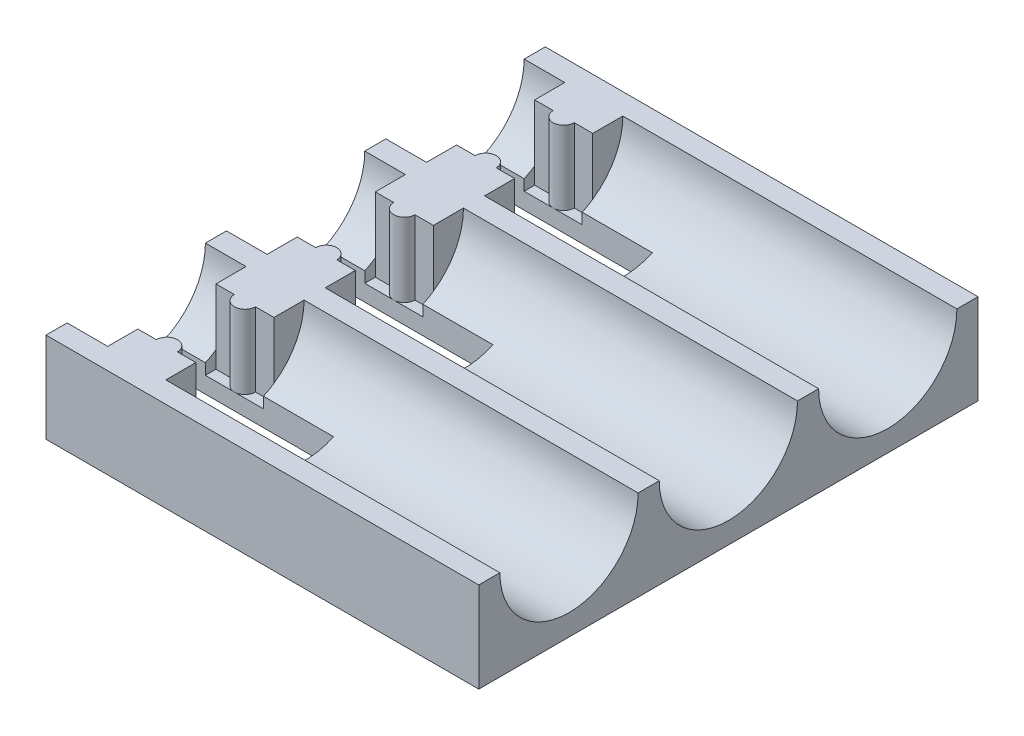
from build123d import *

# Parameters (mm, degrees)
BOSS_EXTRUDE1_DEPTH     = 41
BOSS_EXTRUDE2_REACH     = 50.098
SKETCH2_R               = 1
SKETCH4_W               = 5.5
SKETCH4_H               = 13.1
SKETCH4_R               = 1
CUT_EXTRUDE1_DEPTH      = 7
BOSS_EXTRUDE4_REACH     = 50.098
SKETCH6_W               = 5.5
SKETCH6_H               = 2.85
CUT_EXTRUDE2_DEPTH      = 48.846865116
CUT_EXTRUDE2_DEPTH_BACK = 48.846865116
SKETCH7_W               = 16
SKETCH7_H               = 5.4


with BuildPart() as part:
    # Sketch1 → Boss-Extrude1 (new body)
    with BuildSketch(Plane(origin=(0, 0, 0), x_dir=(0, 0, -1), z_dir=(1, 0, 0))):
        with BuildLine():
            Line((-8.55, 0), (-6.55, 0))
            ThreePointArc((-6.55, 0), (0, -6.55), (6.55, 0))
            Line((6.55, 0), (8.55, 0))
            ThreePointArc((8.55, 0), (15.1, -6.55), (21.65, 0))
            Line((21.65, 0), (23.65, 0))
            Line((23.65, 0), (23.65, -8.55))
            Line((23.65, -8.55), (-23.65, -8.55))
            Line((-23.65, -8.55), (-23.65, 0))
            Line((-23.65, 0), (-21.65, 0))
            ThreePointArc((-21.65, 0), (-15.1, -6.55), (-8.55, 0))
        make_face()
    extrude(amount=BOSS_EXTRUDE1_DEPTH)

    # Sketch2 → Boss-Extrude2 (add, up to next)
    with BuildSketch(Plane(origin=(0, 0, 0), x_dir=(1, 0, 0), z_dir=(0, 1, 0)), mode=Mode.PRIVATE) as boss_extrude2_sk1:
        with Locations(Location((6.6, 3.7, 0), (0, 0, 270))):
            Circle(SKETCH2_R)
    boss_extrude2_tool1 = extrude(boss_extrude2_sk1.sketch, amount=-BOSS_EXTRUDE2_REACH, mode=Mode.PRIVATE) - part.part
    # Sketch2 → Boss-Extrude2 (add, up to next)
    with BuildSketch(Plane(origin=(0, 0, 0), x_dir=(1, 0, 0), z_dir=(0, 1, 0)), mode=Mode.PRIVATE) as boss_extrude2_sk2:
        with Locations(Location((6.6, -3.7, 0), (0, 0, 270))):
            Circle(SKETCH2_R)
    boss_extrude2_tool2 = extrude(boss_extrude2_sk2.sketch, amount=-BOSS_EXTRUDE2_REACH, mode=Mode.PRIVATE) - part.part
    # Sketch2 → Boss-Extrude2 (add, up to next)
    with BuildSketch(Plane(origin=(0, 0, 0), x_dir=(1, 0, 0), z_dir=(0, 1, 0)), mode=Mode.PRIVATE) as boss_extrude2_sk3:
        with Locations(Location((6.6, -11.4, 0), (0, 0, 270))):
            Circle(SKETCH2_R)
    boss_extrude2_tool3 = extrude(boss_extrude2_sk3.sketch, amount=-BOSS_EXTRUDE2_REACH, mode=Mode.PRIVATE) - part.part
    # Sketch2 → Boss-Extrude2 (add, up to next)
    with BuildSketch(Plane(origin=(0, 0, 0), x_dir=(1, 0, 0), z_dir=(0, 1, 0)), mode=Mode.PRIVATE) as boss_extrude2_sk4:
        with Locations(Location((6.6, -18.8, 0), (0, 0, 270))):
            Circle(SKETCH2_R)
    boss_extrude2_tool4 = extrude(boss_extrude2_sk4.sketch, amount=-BOSS_EXTRUDE2_REACH, mode=Mode.PRIVATE) - part.part
    # Sketch2 → Boss-Extrude2 (add, up to next)
    with BuildSketch(Plane(origin=(0, 0, 0), x_dir=(1, 0, 0), z_dir=(0, 1, 0)), mode=Mode.PRIVATE) as boss_extrude2_sk5:
        with Locations(Location((6.6, 18.8, 0), (0, 0, 270))):
            Circle(SKETCH2_R)
    boss_extrude2_tool5 = extrude(boss_extrude2_sk5.sketch, amount=-BOSS_EXTRUDE2_REACH, mode=Mode.PRIVATE) - part.part
    # Sketch2 → Boss-Extrude2 (add, up to next)
    with BuildSketch(Plane(origin=(0, 0, 0), x_dir=(1, 0, 0), z_dir=(0, 1, 0)), mode=Mode.PRIVATE) as boss_extrude2_sk6:
        with Locations(Location((6.6, 11.4, 0), (0, 0, 270))):
            Circle(SKETCH2_R)
    boss_extrude2_tool6 = extrude(boss_extrude2_sk6.sketch, amount=-BOSS_EXTRUDE2_REACH, mode=Mode.PRIVATE) - part.part
    add(boss_extrude2_tool1.solids().sort_by_distance((6.6, 0, -3.7))[0])
    add(boss_extrude2_tool2.solids().sort_by_distance((6.6, 0, 3.7))[0])
    add(boss_extrude2_tool3.solids().sort_by_distance((6.6, 0, 11.4))[0])
    add(boss_extrude2_tool4.solids().sort_by_distance((6.6, 0, 18.8))[0])
    add(boss_extrude2_tool5.solids().sort_by_distance((6.6, 0, -18.8))[0])
    add(boss_extrude2_tool6.solids().sort_by_distance((6.6, 0, -11.4))[0])

    # Sketch4 → Cut-Extrude1 (cut)
    # profile 1 of 3: a face of its own
    with BuildSketch(Plane(origin=(0, 0, 0), x_dir=(1, 0, 0), z_dir=(0, 1, 0))):
        with Locations((6.6, 0)):
            Rectangle(SKETCH4_W, SKETCH4_H)
        with Locations(Location((6.6, 3.7, 0), (0, 0, 270))):
            Circle(SKETCH4_R, mode=Mode.SUBTRACT)
        with Locations(Location((6.6, -3.7, 0), (0, 0, 270))):
            Circle(SKETCH4_R, mode=Mode.SUBTRACT)
    # profile 2 of 3: a face of its own
    with BuildSketch(Plane(origin=(0, 0, 0), x_dir=(1, 0, 0), z_dir=(0, 1, 0))):
        with Locations((6.6, -15.1)):
            Rectangle(SKETCH4_W, SKETCH4_H)
        with Locations(Location((6.6, -11.4, 0), (0, 0, 90))):
            Circle(SKETCH4_R, mode=Mode.SUBTRACT)
        with Locations(Location((6.6, -18.8, 0), (0, 0, 90))):
            Circle(SKETCH4_R, mode=Mode.SUBTRACT)
    # profile 3 of 3: a face of its own
    with BuildSketch(Plane(origin=(0, 0, 0), x_dir=(1, 0, 0), z_dir=(0, 1, 0))):
        with Locations((6.6, 15.1)):
            Rectangle(SKETCH4_W, SKETCH4_H)
        with Locations(Location((6.6, 11.4, 0), (0, 0, 90))):
            Circle(SKETCH4_R, mode=Mode.SUBTRACT)
        with Locations(Location((6.6, 18.8, 0), (0, 0, 90))):
            Circle(SKETCH4_R, mode=Mode.SUBTRACT)
    extrude(amount=-CUT_EXTRUDE1_DEPTH, mode=Mode.SUBTRACT)

    # Boss-Extrude4: up to this face of the body (flat: up to its plane)
    boss_extrude4_end = Plane(part.part.faces().sort_by_distance((6.6, -7, -15.1))[0])
    # Sketch6 → Boss-Extrude4 (add, up to the picked face)
    with BuildSketch(Plane(origin=(0, 0, 0), x_dir=(1, 0, 0), z_dir=(0, 1, 0)), mode=Mode.PRIVATE) as boss_extrude4_sk1:
        with Locations((6.6, -5.125)):
            Rectangle(SKETCH6_W, SKETCH6_H)
    boss_extrude4_tool1 = split(extrude(boss_extrude4_sk1.sketch, amount=-BOSS_EXTRUDE4_REACH, mode=Mode.PRIVATE), bisect_by=boss_extrude4_end, keep=Keep.BOTH, mode=Mode.PRIVATE)
    # Sketch6 → Boss-Extrude4 (add, up to the picked face)
    with BuildSketch(Plane(origin=(0, 0, 0), x_dir=(1, 0, 0), z_dir=(0, 1, 0)), mode=Mode.PRIVATE) as boss_extrude4_sk2:
        with Locations((6.6, 5.125)):
            Rectangle(SKETCH6_W, SKETCH6_H)
    boss_extrude4_tool2 = split(extrude(boss_extrude4_sk2.sketch, amount=-BOSS_EXTRUDE4_REACH, mode=Mode.PRIVATE), bisect_by=boss_extrude4_end, keep=Keep.BOTH, mode=Mode.PRIVATE)
    # Sketch6 → Boss-Extrude4 (add, up to the picked face)
    with BuildSketch(Plane(origin=(0, 0, 0), x_dir=(1, 0, 0), z_dir=(0, 1, 0)), mode=Mode.PRIVATE) as boss_extrude4_sk3:
        with Locations((6.6, -20.225)):
            Rectangle(SKETCH6_W, SKETCH6_H)
    boss_extrude4_tool3 = split(extrude(boss_extrude4_sk3.sketch, amount=-BOSS_EXTRUDE4_REACH, mode=Mode.PRIVATE), bisect_by=boss_extrude4_end, keep=Keep.BOTH, mode=Mode.PRIVATE)
    # Sketch6 → Boss-Extrude4 (add, up to the picked face)
    with BuildSketch(Plane(origin=(0, 0, 0), x_dir=(1, 0, 0), z_dir=(0, 1, 0)), mode=Mode.PRIVATE) as boss_extrude4_sk4:
        with Locations((6.6, -9.975)):
            Rectangle(SKETCH6_W, SKETCH6_H)
    boss_extrude4_tool4 = split(extrude(boss_extrude4_sk4.sketch, amount=-BOSS_EXTRUDE4_REACH, mode=Mode.PRIVATE), bisect_by=boss_extrude4_end, keep=Keep.BOTH, mode=Mode.PRIVATE)
    # Sketch6 → Boss-Extrude4 (add, up to the picked face)
    with BuildSketch(Plane(origin=(0, 0, 0), x_dir=(1, 0, 0), z_dir=(0, 1, 0)), mode=Mode.PRIVATE) as boss_extrude4_sk5:
        with Locations((6.6, 9.975)):
            Rectangle(SKETCH6_W, SKETCH6_H)
    boss_extrude4_tool5 = split(extrude(boss_extrude4_sk5.sketch, amount=-BOSS_EXTRUDE4_REACH, mode=Mode.PRIVATE), bisect_by=boss_extrude4_end, keep=Keep.BOTH, mode=Mode.PRIVATE)
    # Sketch6 → Boss-Extrude4 (add, up to the picked face)
    with BuildSketch(Plane(origin=(0, 0, 0), x_dir=(1, 0, 0), z_dir=(0, 1, 0)), mode=Mode.PRIVATE) as boss_extrude4_sk6:
        with Locations((6.6, 20.225)):
            Rectangle(SKETCH6_W, SKETCH6_H)
    boss_extrude4_tool6 = split(extrude(boss_extrude4_sk6.sketch, amount=-BOSS_EXTRUDE4_REACH, mode=Mode.PRIVATE), bisect_by=boss_extrude4_end, keep=Keep.BOTH, mode=Mode.PRIVATE)
    add(boss_extrude4_tool1.solids().sort_by(Axis((6.6, 0, 5.125), (0, -1, 0)))[0])
    add(boss_extrude4_tool2.solids().sort_by(Axis((6.6, 0, -5.125), (0, -1, 0)))[0])
    add(boss_extrude4_tool3.solids().sort_by(Axis((6.6, 0, 20.225), (0, -1, 0)))[0])
    add(boss_extrude4_tool4.solids().sort_by(Axis((6.6, 0, 9.975), (0, -1, 0)))[0])
    add(boss_extrude4_tool5.solids().sort_by(Axis((6.6, 0, -9.975), (0, -1, 0)))[0])
    add(boss_extrude4_tool6.solids().sort_by(Axis((6.6, 0, -20.225), (0, -1, 0)))[0])

    # Sketch7 → Cut-Extrude2 (cut, two sides: drawn at the far end of the back side and taken through both)
    with BuildSketch(Plane(origin=(0, -7, 0), x_dir=(1, 0, 0), z_dir=(0, 1, 0)).offset(-CUT_EXTRUDE2_DEPTH_BACK)):
        with Locations((8, 0)):
            Rectangle(SKETCH7_W, SKETCH7_H)
        with Locations((8, -15.1)):
            Rectangle(SKETCH7_W, SKETCH7_H)
        with Locations((8, 15.1)):
            Rectangle(SKETCH7_W, SKETCH7_H)
    extrude(amount=CUT_EXTRUDE2_DEPTH + CUT_EXTRUDE2_DEPTH_BACK, mode=Mode.SUBTRACT)


solid = part.part
